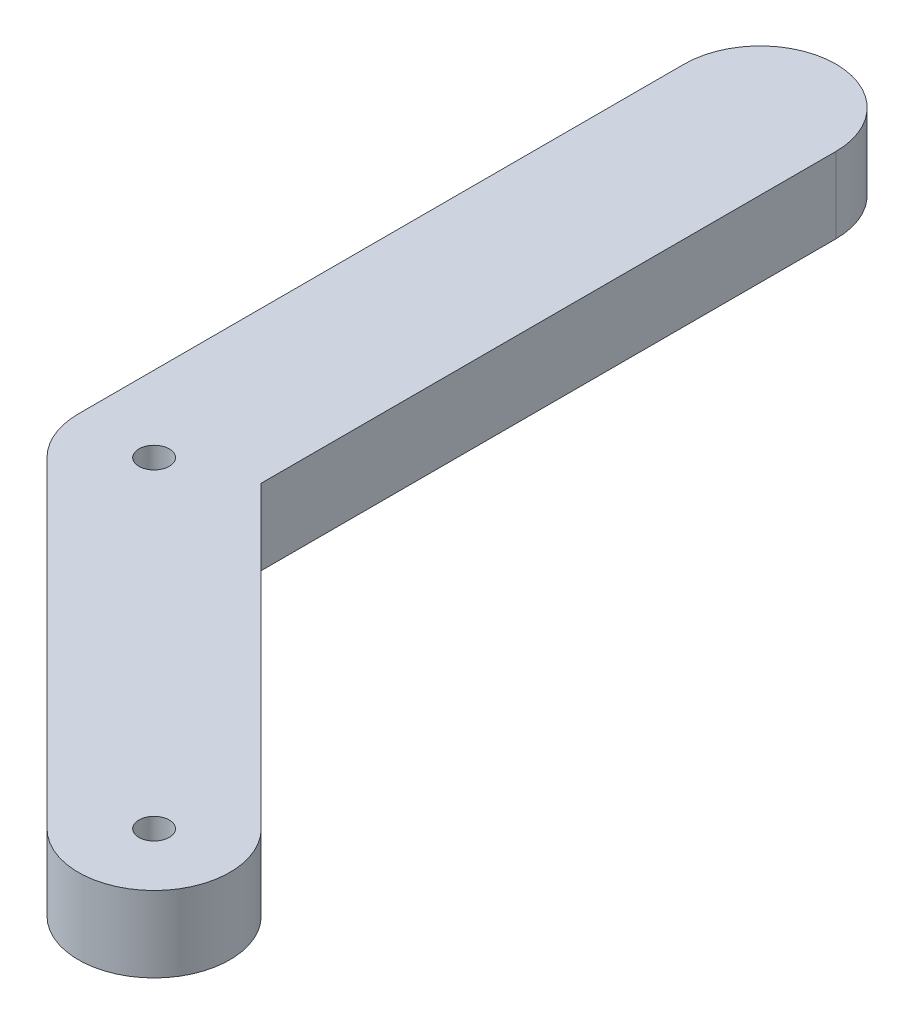
from build123d import *

# Parameters (mm, degrees)
SKETCH3_R           = 1
BOSS_EXTRUDE2_DEPTH = 5


with BuildPart() as part:
    # Sketch3 → Boss-Extrude2 (new body)
    with BuildSketch(Plane(origin=(0, 0, 0), x_dir=(1, 0, 0), z_dir=(0, 1, 0))):
        with BuildLine():
            Line((-5, 40), (-5, 0))
            ThreePointArc((-5, 0), (-4.619397663, -1.913417162), (-3.535533906, -3.535533906))
            Line((-3.535533906, -3.535533906), (17.67766953, -24.748737342))
            ThreePointArc((17.67766953, -24.748737342), (24.748737342, -24.748737342), (24.748737342, -17.67766953))
            Line((24.748737342, -17.67766953), (5, 2.071067812))
            Line((5, 2.071067812), (5, 40))
            ThreePointArc((5, 40), (0, 45), (-5, 40))
        make_face()
        with Locations(Location((0, 0, 0), (0, 0, 270))):
            Circle(SKETCH3_R, mode=Mode.SUBTRACT)
        with Locations(Location((21.213203436, -21.213203436, 0), (0, 0, 270))):
            Circle(SKETCH3_R, mode=Mode.SUBTRACT)
    extrude(amount=BOSS_EXTRUDE2_DEPTH)


solid = part.part
